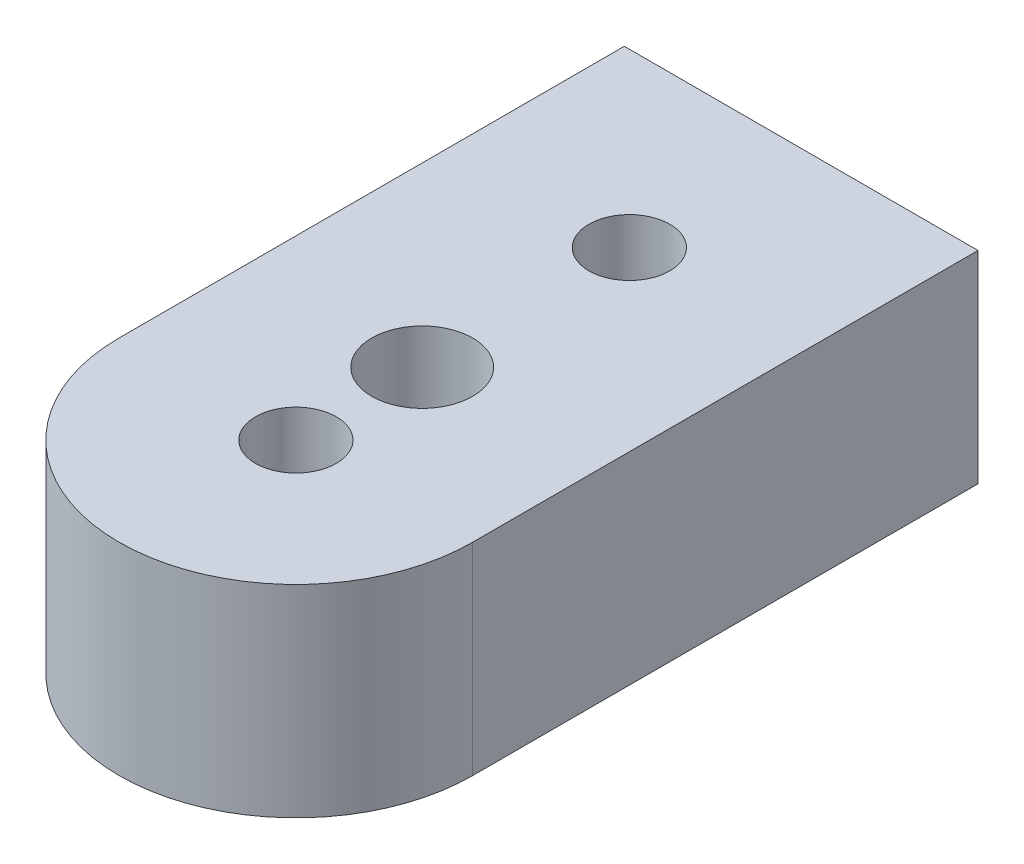
from build123d import *

# Parameters (mm, degrees)
SKETCH1_R           = 1.6
SKETCH1_R_2         = 2
BOSS_EXTRUDE1_DEPTH = 8


with BuildPart() as part:
    # Sketch1 → Boss-Extrude1 (new body)
    with BuildSketch(Plane(origin=(0, 0, 0), x_dir=(1, 0, 0), z_dir=(0, 1, 0))):
        with BuildLine():
            Line((-7, 15), (7, 15))
            Line((7, 15), (7, -5))
            ThreePointArc((7, -5), (0, -12), (-7, -5))
            Line((-7, -5), (-7, 15))
        make_face()
        with Locations(Location((0, -5, 0), (0, 0, 270))):
            Circle(SKETCH1_R, mode=Mode.SUBTRACT)
        with Locations(Location((0, 8.2, 0), (0, 0, 270))):
            Circle(SKETCH1_R, mode=Mode.SUBTRACT)
        with Locations(Location((0, 0, 0), (0, 0, 270))):
            Circle(SKETCH1_R_2, mode=Mode.SUBTRACT)
    extrude(amount=BOSS_EXTRUDE1_DEPTH)


solid = part.part
